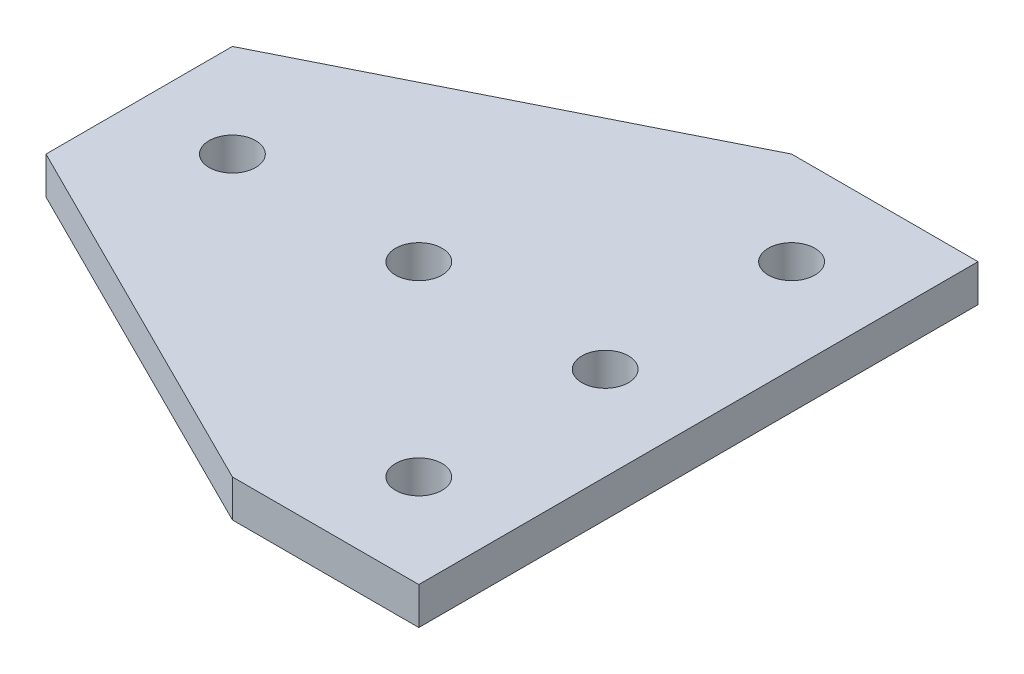
from build123d import *

# Parameters (mm, degrees)
SKETCH1_R           = 2.5
BOSS_EXTRUDE1_DEPTH = 4


with BuildPart() as part:
    # Sketch1 → Boss-Extrude1 (new body)
    with BuildSketch(Plane(origin=(0, 0, 0), x_dir=(1, 0, 0), z_dir=(0, 1, 0))):
        Polygon((10, 30), (10, -30), (-10, -30), (-50, -10), (-50, 10), (-10, 30), align=None)
        with Locations(Location((0, 0, 0), (0, 0, 270))):
            Circle(SKETCH1_R, mode=Mode.SUBTRACT)
        with Locations(Location((0, 20, 0), (0, 0, 270))):
            Circle(SKETCH1_R, mode=Mode.SUBTRACT)
        with Locations(Location((0, -20, 0), (0, 0, 270))):
            Circle(SKETCH1_R, mode=Mode.SUBTRACT)
        with Locations(Location((-20, 0, 0), (0, 0, 270))):
            Circle(SKETCH1_R, mode=Mode.SUBTRACT)
        with Locations(Location((-40, 0, 0), (0, 0, 270))):
            Circle(SKETCH1_R, mode=Mode.SUBTRACT)
    extrude(amount=BOSS_EXTRUDE1_DEPTH)


solid = part.part
